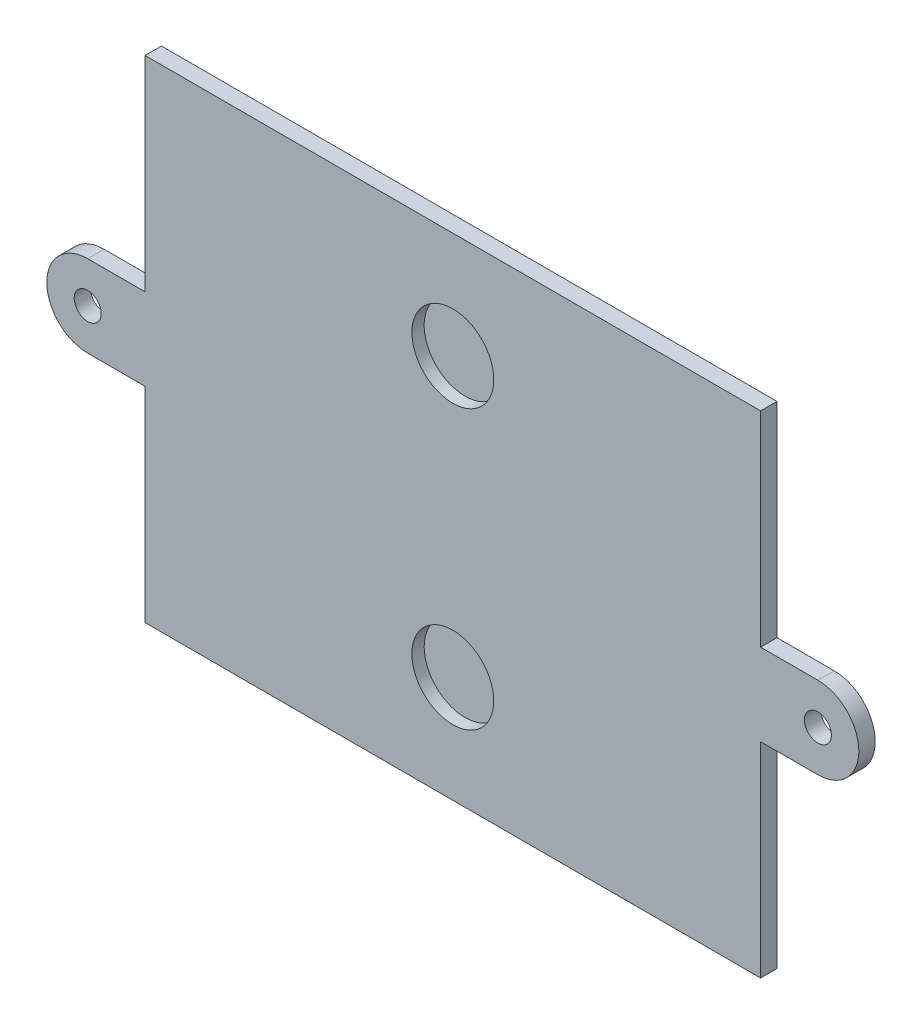
from build123d import *

# Parameters (mm, degrees)
SKETCH2_W           = 75.2
SKETCH2_H           = 60
SKETCH2_R           = 1.65
BOSS_EXTRUDE1_DEPTH = 2
SKETCH3_R           = 5
CUT_EXTRUDE1_DEPTH  = 1.5


with BuildPart() as part:
    # Sketch2 → Boss-Extrude1 (new body)
    # profile 1 of 3: a face of its own
    with BuildSketch(Plane.XY):
        with Locations((37.6, 30)):
            Rectangle(SKETCH2_W, SKETCH2_H)
    # profile 2 of 3: a face of its own
    with BuildSketch(Plane.XY):
        with BuildLine():
            Line((0, 35), (-7, 35))
            ThreePointArc((-7, 35), (-12, 30), (-7, 25))
            Line((-7, 25), (0, 25))
            Line((0, 25), (0, 35))
        make_face()
        with Locations((-7, 30)):
            Circle(SKETCH2_R, mode=Mode.SUBTRACT)
    # profile 3 of 3: a face of its own
    with BuildSketch(Plane.XY):
        with BuildLine():
            Line((82.2, 25), (75.2, 25))
            Line((75.2, 25), (75.2, 35))
            Line((75.2, 35), (82.2, 35))
            ThreePointArc((82.2, 35), (87.2, 30), (82.2, 25))
        make_face()
        with Locations((82.2, 30)):
            Circle(SKETCH2_R, mode=Mode.SUBTRACT)
    extrude(amount=BOSS_EXTRUDE1_DEPTH)

    # Sketch3 → Cut-Extrude1 (cut)
    with BuildSketch(Plane.XY.offset(2)):
        with Locations((37.6, 47)):
            Circle(SKETCH3_R)
        with Locations(Location((37.6, 13, 0), (0, 0, 180))):
            Circle(SKETCH3_R)
    extrude(amount=-CUT_EXTRUDE1_DEPTH, mode=Mode.SUBTRACT)


solid = part.part
